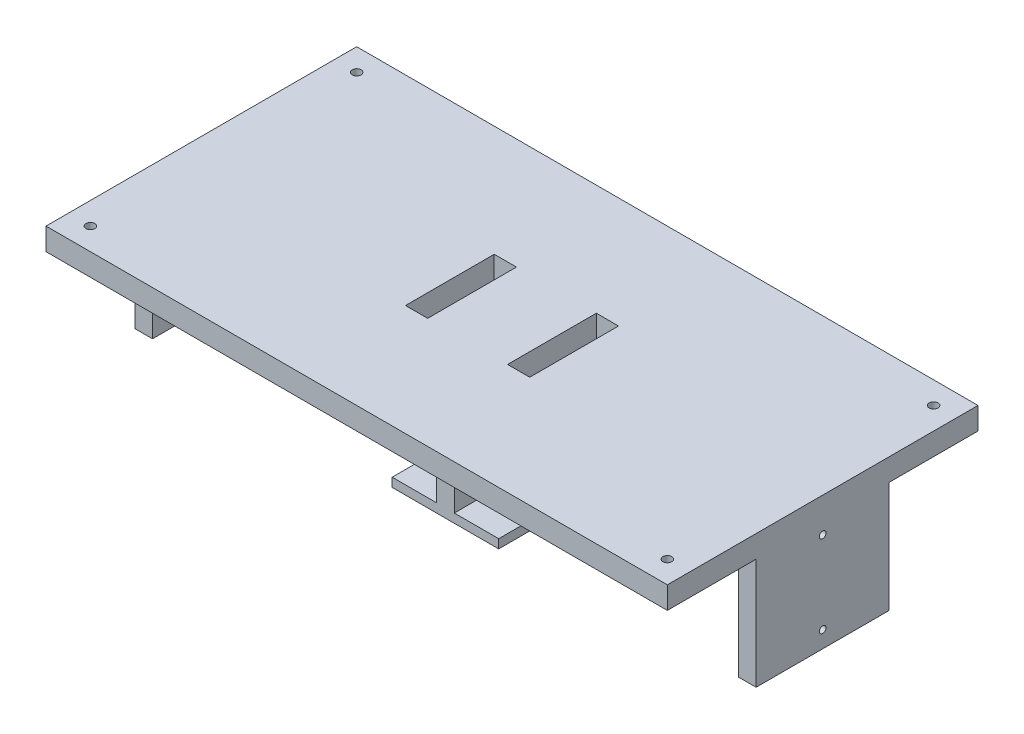
from build123d import *

# Parameters (mm, degrees)
SZKIC1_W                    = 140
SZKIC1_H                    = 70
DODANIE_WYCI_GNI_CIE1_DEPTH = 5
SZKIC2_W                    = 4
SZKIC2_H                    = 30
DODANIE_WYCI_GNI_CIE2_DEPTH = 25
SZKIC3_W                    = 10
SZKIC3_H                    = 30
SZKIC3_W_2                  = 2
DODANIE_WYCI_GNI_CIE3_DEPTH = 2
SZKIC4_R                    = 0.75
WYTNIJ_WYCI_GNI_CIE1_DEPTH  = 12
WYTNIJ_WYCI_GNI_CIE2_START  = -12
SZKIC5_R                    = 0.75
WYTNIJ_WYCI_GNI_CIE2_DEPTH  = 12
SZKIC6_W                    = 5
SZKIC6_H                    = 20
WYTNIJ_WYCI_GNI_CIE3_DEPTH  = 12
SZKIC8_R                    = 1
WYTNIJ_WYCI_GNI_CIE4_DEPTH  = 12


with BuildPart() as part:
    # Szkic1 → Dodanie-wyciągnięcie1 (new body)
    with BuildSketch(Plane(origin=(0, 0, 0), x_dir=(1, 0, 0), z_dir=(0, 1, 0))):
        with Locations((70, -35)):
            Rectangle(SZKIC1_W, SZKIC1_H)
    extrude(amount=DODANIE_WYCI_GNI_CIE1_DEPTH)

    # Szkic2 → Dodanie-wyciągnięcie2 (add)
    with BuildSketch(Plane.XZ):
        with Locations((2, 35)):
            Rectangle(SZKIC2_W, SZKIC2_H)
        with Locations((138, 35)):
            Rectangle(SZKIC2_W, SZKIC2_H)
        with Locations((70, 35)):
            Rectangle(SZKIC2_W, SZKIC2_H)
    extrude(amount=DODANIE_WYCI_GNI_CIE2_DEPTH)

    # Szkic3 → Dodanie-wyciągnięcie3 (add)
    with BuildSketch(Plane.XZ.offset(25)):
        with Locations((77, 35)):
            Rectangle(SZKIC3_W, SZKIC3_H)
        with Locations((63, 35)):
            Rectangle(SZKIC3_W, SZKIC3_H)
        with Locations((71, 35)):
            Rectangle(SZKIC3_W_2, SZKIC3_H)
        with Locations((69, 35)):
            Rectangle(SZKIC3_W_2, SZKIC3_H)
    extrude(amount=DODANIE_WYCI_GNI_CIE3_DEPTH)

    # Szkic4 → Wytnij-wyciągnięcie1 (cut)
    with BuildSketch(Plane.ZY):
        with Locations((35, -2.75)):
            Circle(SZKIC4_R)
        with Locations((35, -21.25)):
            Circle(SZKIC4_R)
    extrude(amount=-WYTNIJ_WYCI_GNI_CIE1_DEPTH, mode=Mode.SUBTRACT)

    # Szkic5 → Wytnij-wyciągnięcie2 (cut)
    with BuildSketch(Plane(origin=(140, 0, 0), x_dir=(0, 0, -1), z_dir=(1, 0, 0)).offset(WYTNIJ_WYCI_GNI_CIE2_START)):
        with Locations(Location((-35, -21.25, 0), (0, 0, 180))):
            Circle(SZKIC5_R)
        with Locations(Location((-35, -2.75, 0), (0, 0, 180))):
            Circle(SZKIC5_R)
    extrude(amount=WYTNIJ_WYCI_GNI_CIE2_DEPTH, mode=Mode.SUBTRACT)

    # Szkic6 → Wytnij-wyciągnięcie3 (cut)
    with BuildSketch(Plane(origin=(0, 5, 0), x_dir=(1, 0, 0), z_dir=(0, 1, 0))):
        with Locations((58.5, -35)):
            Rectangle(SZKIC6_W, SZKIC6_H)
        with Locations((81.5, -35)):
            Rectangle(SZKIC6_W, SZKIC6_H)
    extrude(amount=-WYTNIJ_WYCI_GNI_CIE3_DEPTH, mode=Mode.SUBTRACT)

    # Szkic8 → Wytnij-wyciągnięcie4 (cut)
    with BuildSketch(Plane(origin=(0, 5, 0), x_dir=(1, 0, 0), z_dir=(0, 1, 0))):
        with Locations(Location((135, -65, 0), (0, 0, 270))):
            Circle(SZKIC8_R)
        with Locations(Location((135, -5, 0), (0, 0, 270))):
            Circle(SZKIC8_R)
        with Locations(Location((5, -5, 0), (0, 0, 270))):
            Circle(SZKIC8_R)
        with Locations(Location((5, -65, 0), (0, 0, 270))):
            Circle(SZKIC8_R)
    extrude(amount=-WYTNIJ_WYCI_GNI_CIE4_DEPTH, mode=Mode.SUBTRACT)


solid = part.part
